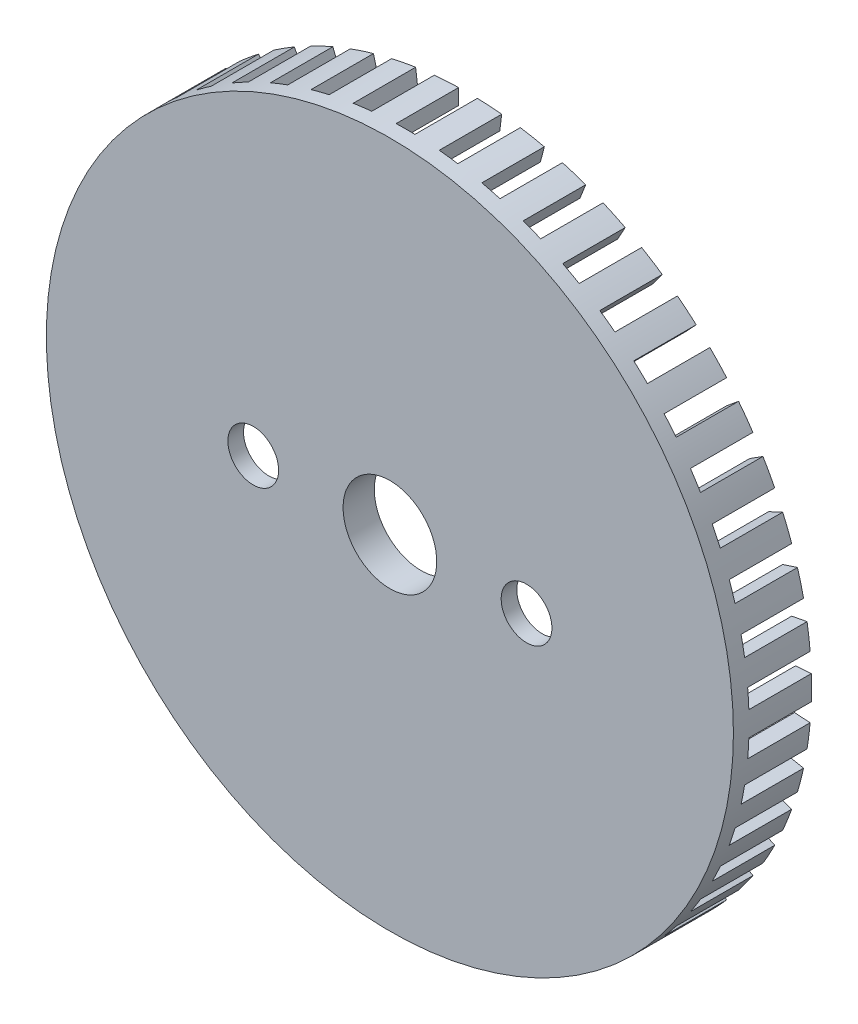
from build123d import *

# Parameters (mm, degrees)
ESBO_O1_R                = 22
RESSALTO_EXTRUS_O1_DEPTH = 5
CASCA1_T                 = -1
CORTE_EXTRUS_O1_START    = 10
ESBO_O3_W                = 1.2
ESBO_O3_H                = 4
CORTE_EXTRUS_O1_DEPTH    = 22.511902513
PADR_OCIRCULAR1_COUNT    = 50
ESBO_O12_R               = 1.625
CORTE_EXTRUS_O4_DEPTH    = 32.511902513
ESBO_O15_R               = 4.4
RESSALTO_EXTRUS_O6_DEPTH = 1
ESBO_O16_R               = 3
CORTE_EXTRUS_O5_DEPTH    = 32.256999216


with BuildPart() as part:
    # Esboço1 → Ressalto-extrusão1 (new body)
    with BuildSketch(Plane.XY):
        Circle(ESBO_O1_R)
    extrude(amount=RESSALTO_EXTRUS_O1_DEPTH)

    # Casca1
    casca1_openings = [part.faces().sort_by_distance(p)[0] for p in [
        (0, 0, 0),
    ]]
    offset(amount=CASCA1_T, openings=casca1_openings, kind=Kind.INTERSECTION)

    # Esboço3 → Corte-extrusão1 (cut, through all)
    with BuildSketch(Plane(origin=(0, 0, 0), x_dir=(1, 0, 0), z_dir=(0, 1, 0)).offset(CORTE_EXTRUS_O1_START)):
        with Locations((0, -2)):
            Rectangle(ESBO_O3_W, ESBO_O3_H)
    corte_extrus_o1 = extrude(amount=CORTE_EXTRUS_O1_DEPTH, mode=Mode.SUBTRACT)

    # PadrãoCircular1: Corte-extrusão1 ×50 about axis
    padr_ocircular1_axis = Axis((0, 0, 0), (0, 0, 1))
    for i in range(1, PADR_OCIRCULAR1_COUNT):
        add(corte_extrus_o1.rotate(padr_ocircular1_axis, i * 360 / PADR_OCIRCULAR1_COUNT), mode=Mode.SUBTRACT)

    # Esboço12 → Corte-extrusão4 (cut, through all)
    with BuildSketch(Plane.XY.offset(5)):
        with Locations((-8.75, 0)):
            Circle(ESBO_O12_R)
        with Locations((8.75, 0)):
            Circle(ESBO_O12_R)
    extrude(amount=-CORTE_EXTRUS_O4_DEPTH, mode=Mode.SUBTRACT)

    # Esboço15 → Ressalto-extrusão6 (add)
    with BuildSketch(Plane(origin=(0, 0, 4), x_dir=(-1, 0, 0), z_dir=(0, 0, -1))):
        with Locations(Location((0, 0, 0), (0, 0, 180))):
            Circle(ESBO_O15_R)
    extrude(amount=RESSALTO_EXTRUS_O6_DEPTH)

    # Esboço16 → Corte-extrusão5 (cut, through all)
    with BuildSketch(Plane(origin=(0, 0, 3), x_dir=(-1, 0, 0), z_dir=(0, 0, -1))):
        Circle(ESBO_O16_R)
    extrude(amount=-CORTE_EXTRUS_O5_DEPTH, mode=Mode.SUBTRACT)


solid = part.part
